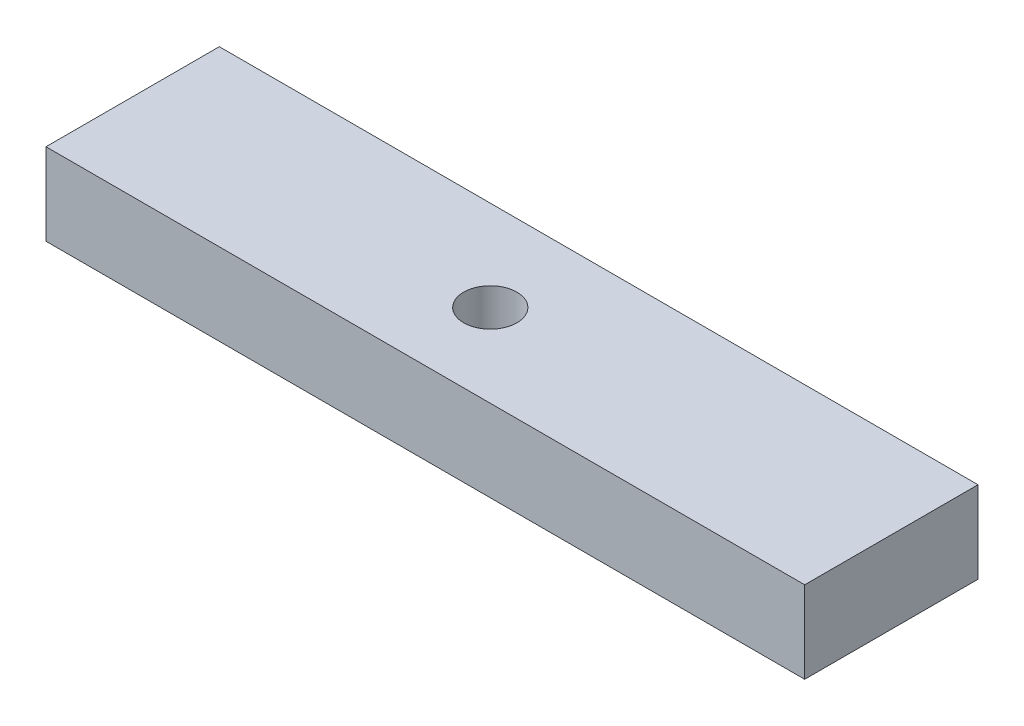
from build123d import *

# Parameters (mm, degrees)
SKETCH1_W           = 55.6
SKETCH1_H           = 12.7
BOSS_EXTRUDE1_DEPTH = 6
SKETCH2_R           = 1.95
CUT_EXTRUDE1_DEPTH  = 6


with BuildPart() as part:
    # Sketch1 → Boss-Extrude1 (new body)
    with BuildSketch(Plane(origin=(0, 0, 0), x_dir=(1, 0, 0), z_dir=(0, 1, 0))):
        with Locations((6.792045455, -6.35)):
            Rectangle(SKETCH1_W, SKETCH1_H)
    extrude(amount=BOSS_EXTRUDE1_DEPTH)

    # Sketch2 → Cut-Extrude1 (cut)
    with BuildSketch(Plane(origin=(0, 6, 0), x_dir=(1, 0, 0), z_dir=(0, 1, 0))):
        with Locations(Location((5.471614596, -6.620857612, 0), (0, 0, 270))):
            Circle(SKETCH2_R)
    extrude(amount=-CUT_EXTRUDE1_DEPTH, mode=Mode.SUBTRACT)


solid = part.part
